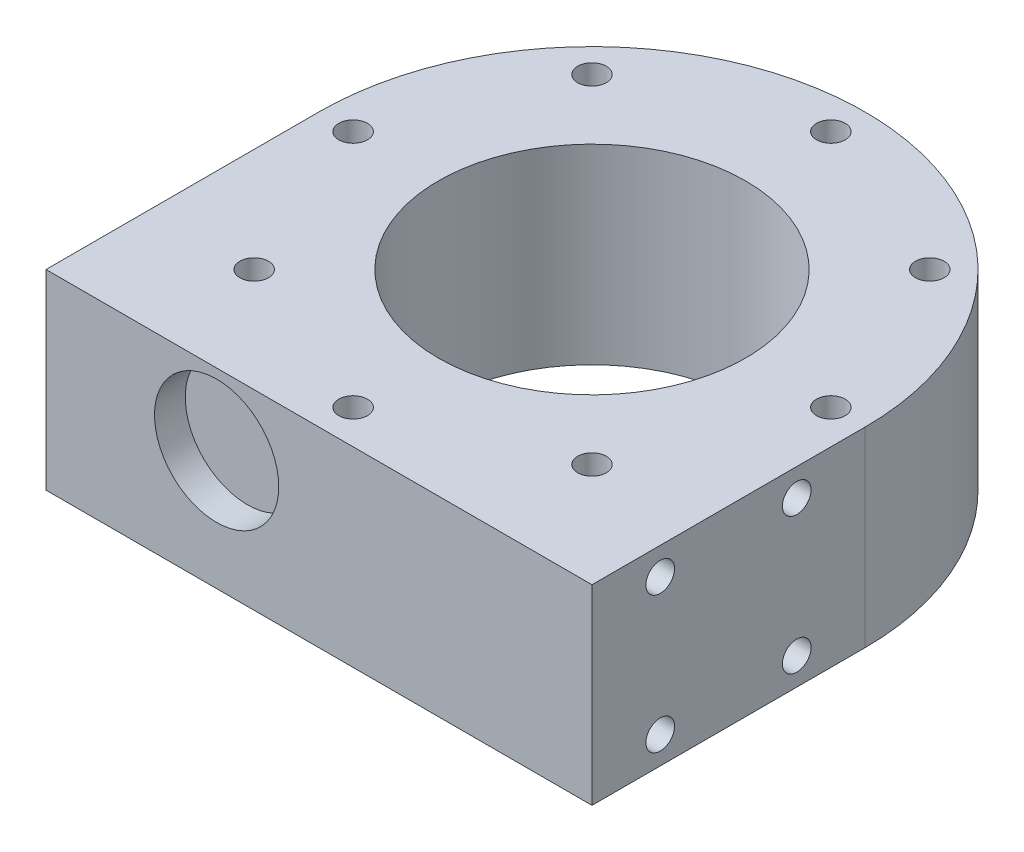
from build123d import *

# Parameters (mm, degrees)
SKETCH_1_R          = 22.5
EXTRUDE_1_DEPTH     = 28
SKETCH_2_R          = 2.1
CUT_EXTRUDE_1_DEPTH = 64.118935352
SKETCH_6_R          = 9.1
CUT_EXTRUDE_2_DEPTH = 4.5
SKETCH_7_R          = 2.1
CUT_EXTRUDE_3_DEPTH = 4


with BuildPart() as part:
    # 草图1 → 凸台-拉伸1 (new body)
    with BuildSketch(Plane(origin=(0, 0, 0), x_dir=(1, 0, 0), z_dir=(0, 1, 0))):
        with BuildLine():
            Line((-40, 0), (-40, -40))
            Line((-40, -40), (40, -40))
            Line((40, -40), (40, 0))
            ThreePointArc((40, 0), (0, 40), (-40, 0))
        make_face()
        with Locations(Location((0, 0, 0), (0, 0, 270))):
            Circle(SKETCH_1_R, mode=Mode.SUBTRACT)
    extrude(amount=EXTRUDE_1_DEPTH)

    # 草图2 → 切除-拉伸1 (cut, through all)
    with BuildSketch(Plane(origin=(0, 28, 0), x_dir=(1, 0, 0), z_dir=(0, 1, 0))):
        with Locations(Location((0, 35, 0), (0, 0, 270))):
            Circle(SKETCH_2_R)
        with Locations(Location((24.748737342, 24.748737342, 0), (0, 0, 270))):
            Circle(SKETCH_2_R)
        with Locations(Location((35, 0, 0), (0, 0, 270))):
            Circle(SKETCH_2_R)
        with Locations(Location((24.748737342, -24.748737342, 0), (0, 0, 270))):
            Circle(SKETCH_2_R)
        with Locations(Location((0, -35, 0), (0, 0, 270))):
            Circle(SKETCH_2_R)
        with Locations(Location((-24.748737342, -24.748737342, 0), (0, 0, 270))):
            Circle(SKETCH_2_R)
        with Locations(Location((-35, 0, 0), (0, 0, 270))):
            Circle(SKETCH_2_R)
        with Locations(Location((-24.748737342, 24.748737342, 0), (0, 0, 270))):
            Circle(SKETCH_2_R)
    extrude(amount=-CUT_EXTRUDE_1_DEPTH, mode=Mode.SUBTRACT)

    # 草图6 → 切除-拉伸2 (cut)
    with BuildSketch(Plane.XY.offset(40)):
        with Locations((-15, 17.5)):
            Circle(SKETCH_6_R)
    extrude(amount=-CUT_EXTRUDE_2_DEPTH, mode=Mode.SUBTRACT)

    # 草图7 → 切除-拉伸3 (cut)
    with BuildSketch(Plane.ZY.offset(40)):
        with Locations((10, 24)):
            Circle(SKETCH_7_R)
        with Locations((30, 24)):
            Circle(SKETCH_7_R)
        with Locations((10, 4)):
            Circle(SKETCH_7_R)
        with Locations((30, 4)):
            Circle(SKETCH_7_R)
    cut_extrude_3 = extrude(amount=-CUT_EXTRUDE_3_DEPTH, mode=Mode.SUBTRACT)

    # 镜向1: 切除-拉伸3 across plane
    add(cut_extrude_3.mirror(Plane.ZY), mode=Mode.SUBTRACT)


solid = part.part
